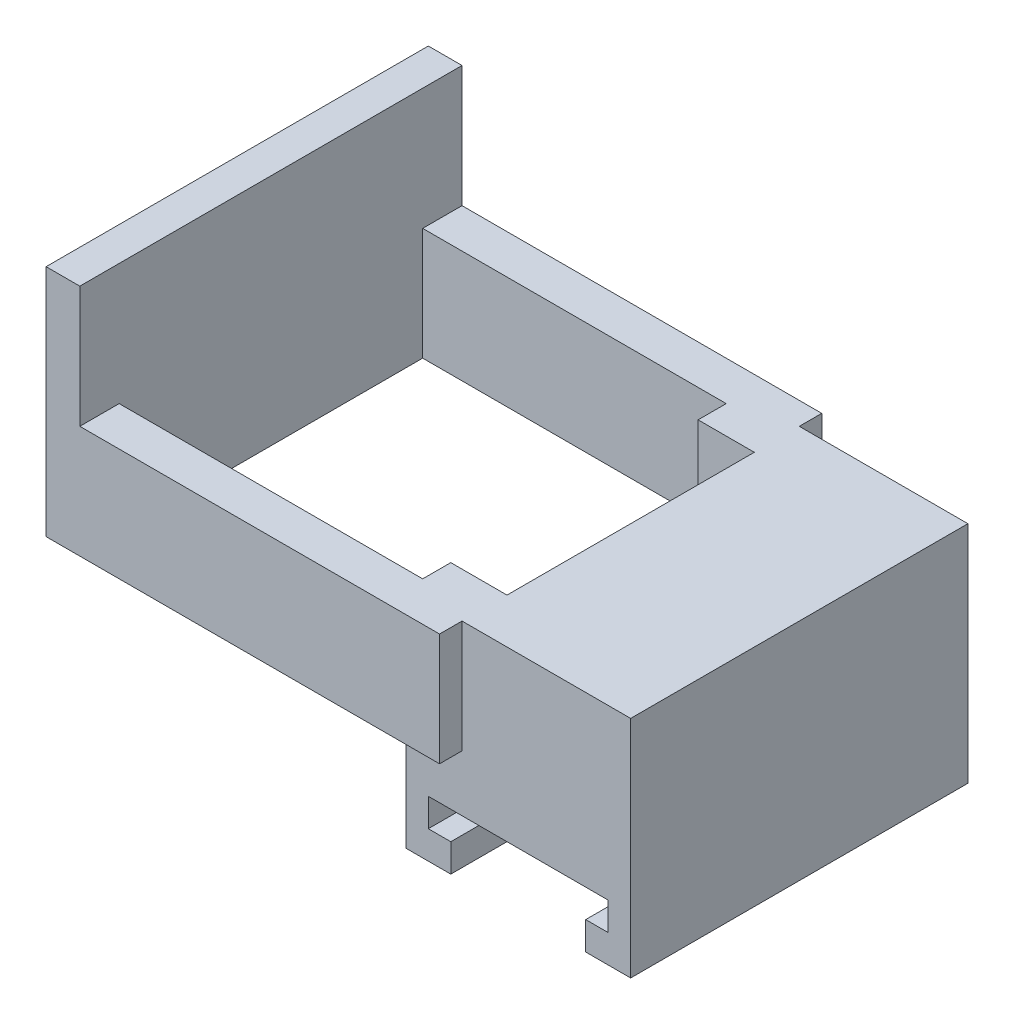
from build123d import *

# Parameters (mm, degrees)
EXTRUDE_1_DEPTH     = 60
SKETCH_2_W          = 7
SKETCH_2_H          = 20
EXTRUDE_2_DEPTH     = 54
SKETCH_3_W          = 4
SKETCH_3_H          = 20
EXTRUDE_3_DEPTH     = 10
SKETCH_4_W          = 68
SKETCH_4_H          = 41.598220465
EXTRUDE_4_DEPTH     = 6
SKETCH_5_W          = 44
SKETCH_5_H          = 25.180333828
CUT_EXTRUDE_1_DEPTH = 10


with BuildPart() as part:
    # 草图1 → 凸台-拉伸1 (new body)
    with BuildSketch(Plane.XY):
        Polygon((-19.732146976, -1.598220465), (-11.732146976, -1.598220465), (-11.732146976, 3.401779535), (-15.732146976, 3.401779535), (-15.732146976, 8.401779535), (16.267853024, 8.401779535), (16.267853024, 3.401779535), (12.267853024, 3.401779535), (12.267853024, -1.598220465), (20.267853024, -1.598220465), (20.267853024, 38.401779535), (-19.732146976, 38.401779535), align=None)
    extrude(amount=EXTRUDE_1_DEPTH)

    # 草图2 → 凸台-拉伸2 (add)
    with BuildSketch(Plane.ZY.offset(19.732146976)):
        with Locations((-0.5, 28.401779535)):
            Rectangle(SKETCH_2_W, SKETCH_2_H)
        with Locations((60.5, 28.401779535)):
            Rectangle(SKETCH_2_W, SKETCH_2_H)
    extrude(amount=EXTRUDE_2_DEPTH)

    # 草图3 → 凸台-拉伸3 (add)
    with BuildSketch(Plane(origin=(-19.732146976, 0, 0), x_dir=(0, 0, -1), z_dir=(1, 0, 0))):
        with Locations((-62, 28.401779535)):
            Rectangle(SKETCH_3_W, SKETCH_3_H)
        with Locations((2, 28.401779535)):
            Rectangle(SKETCH_3_W, SKETCH_3_H)
    extrude(amount=EXTRUDE_3_DEPTH)

    # 草图4 → 凸台-拉伸4 (add)
    with BuildSketch(Plane.ZY.offset(73.732146976)):
        with Locations((30, 39.200889768)):
            Rectangle(SKETCH_4_W, SKETCH_4_H)
    extrude(amount=EXTRUDE_4_DEPTH)

    # 草图5 → 切除-拉伸1 (cut)
    with BuildSketch(Plane.ZY.offset(19.732146976)):
        with Locations((30, 25.991946449)):
            Rectangle(SKETCH_5_W, SKETCH_5_H)
    extrude(amount=-CUT_EXTRUDE_1_DEPTH, mode=Mode.SUBTRACT)


solid = part.part
